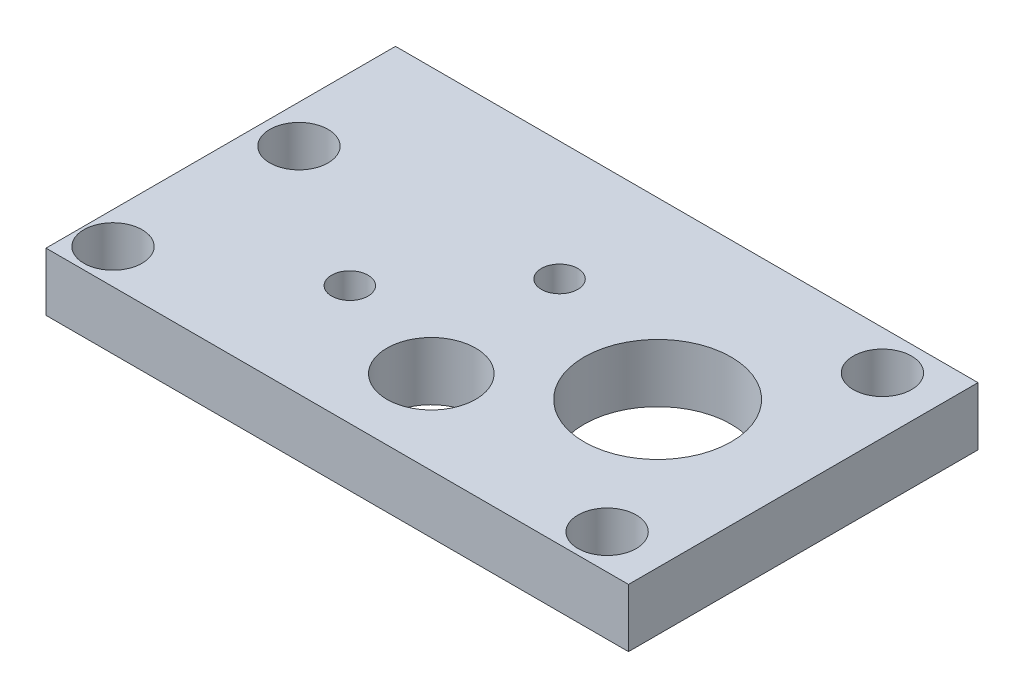
from build123d import *

# Parameters (mm, degrees)
SKETCH_1_W          = 20
SKETCH_1_H          = 12
SKETCH_1_R          = 0.625
SKETCH_1_R_2        = 1.525
SKETCH_1_R_3        = 2.525
EXTRUDE_1_DEPTH     = 2
SKETCH_3_R          = 0.7
CUT_EXTRUDE_1_DEPTH = 24.409399821
SKETCH_3_3_R        = 1
CUT_EXTRUDE_2_DEPTH = 1.5


with BuildPart() as part:
    # 草图1 → 凸台-拉伸1 (new body)
    with BuildSketch(Plane(origin=(0, 0, 0), x_dir=(1, 0, 0), z_dir=(0, 1, 0))):
        with Locations((10, -6)):
            Rectangle(SKETCH_1_W, SKETCH_1_H)
        with Locations((9.732863826, -4.1)):
            Circle(SKETCH_1_R, mode=Mode.SUBTRACT)
        with Locations((10.350101922, -9.120648628)):
            Circle(SKETCH_1_R_2, mode=Mode.SUBTRACT)
        with Locations((6.331393556, -7.9)):
            Circle(SKETCH_1_R, mode=Mode.SUBTRACT)
        with Locations((15, -6)):
            Circle(SKETCH_1_R_3, mode=Mode.SUBTRACT)
    extrude(amount=EXTRUDE_1_DEPTH)

    # 草图3 → 切除-拉伸1 (cut, through all)
    with BuildSketch(Plane(origin=(0, 2, 0), x_dir=(1, 0, 0), z_dir=(0, 1, 0))):
        with Locations((1.101301337, -10.801482832)):
            Circle(SKETCH_3_R)
        with Locations((1.310630289, -4.626278754)):
            Circle(SKETCH_3_R)
        with Locations((18.067159924, -1.34892989)):
            Circle(SKETCH_3_R)
        with Locations((18.067159924, -10.801482832)):
            Circle(SKETCH_3_R)
    extrude(amount=-CUT_EXTRUDE_1_DEPTH, mode=Mode.SUBTRACT)

    # 草图3<3> → 切除-拉伸2 (cut)
    with BuildSketch(Plane(origin=(0, 2, 0), x_dir=(1, 0, 0), z_dir=(0, 1, 0))):
        with Locations((1.310630289, -4.626278754)):
            Circle(SKETCH_3_3_R)
        with Locations((1.101301337, -10.801482832)):
            Circle(SKETCH_3_3_R)
        with Locations((18.067159924, -1.34892989)):
            Circle(SKETCH_3_3_R)
        with Locations((18.067159924, -10.801482832)):
            Circle(SKETCH_3_3_R)
    extrude(amount=-CUT_EXTRUDE_2_DEPTH, mode=Mode.SUBTRACT)


solid = part.part
